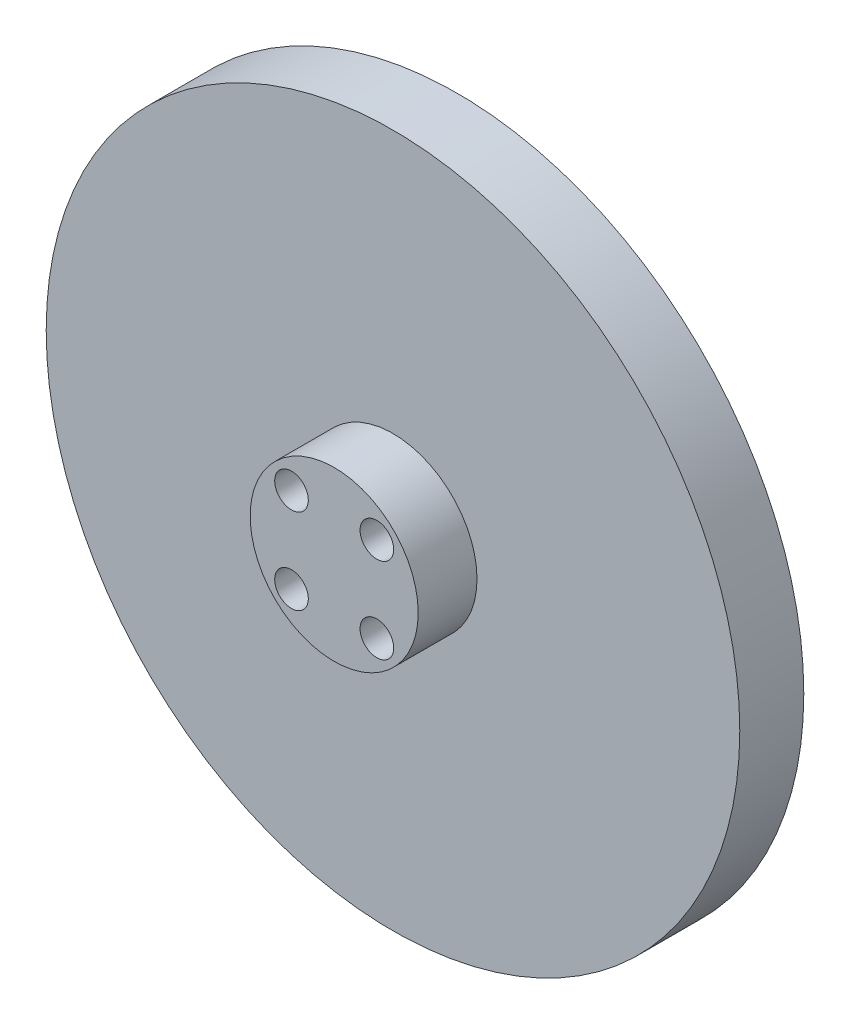
from build123d import *

# Parameters (mm, degrees)
SKETCH5_R           = 41.275
BOSS_EXTRUDE1_DEPTH = 3.81
SKETCH7_R           = 9.999849952
BOSS_EXTRUDE2_DEPTH = 7
SKETCH8_R           = 2
CUT_EXTRUDE1_DEPTH  = 61.174709389
CIRPATTERN1_COUNT   = 4


with BuildPart() as part:
    # Sketch5 → Boss-Extrude1 (new, symmetric)
    with BuildSketch(Plane.XY):
        with Locations(Location((0, 0, 0), (0, 0, 180))):
            Circle(SKETCH5_R)
    extrude(amount=BOSS_EXTRUDE1_DEPTH, both=True)

    # Sketch7 → Boss-Extrude2 (add)
    with BuildSketch(Plane.XY.offset(3.81)):
        Circle(SKETCH7_R)
    extrude(amount=BOSS_EXTRUDE2_DEPTH)

    # Sketch8 → Cut-Extrude1 (cut, through all)
    with BuildSketch(Plane.XY.offset(10.81)):
        with Locations((5.08, 5.08)):
            Circle(SKETCH8_R)
    cut_extrude1 = extrude(amount=-CUT_EXTRUDE1_DEPTH, mode=Mode.SUBTRACT)

    # CirPattern1: Cut-Extrude1 ×4 about axis
    cirpattern1_axis = Axis((0, 0, 0), (0, 0, 1))
    for i in range(1, CIRPATTERN1_COUNT):
        add(cut_extrude1.rotate(cirpattern1_axis, i * 360 / CIRPATTERN1_COUNT), mode=Mode.SUBTRACT)


solid = part.part
